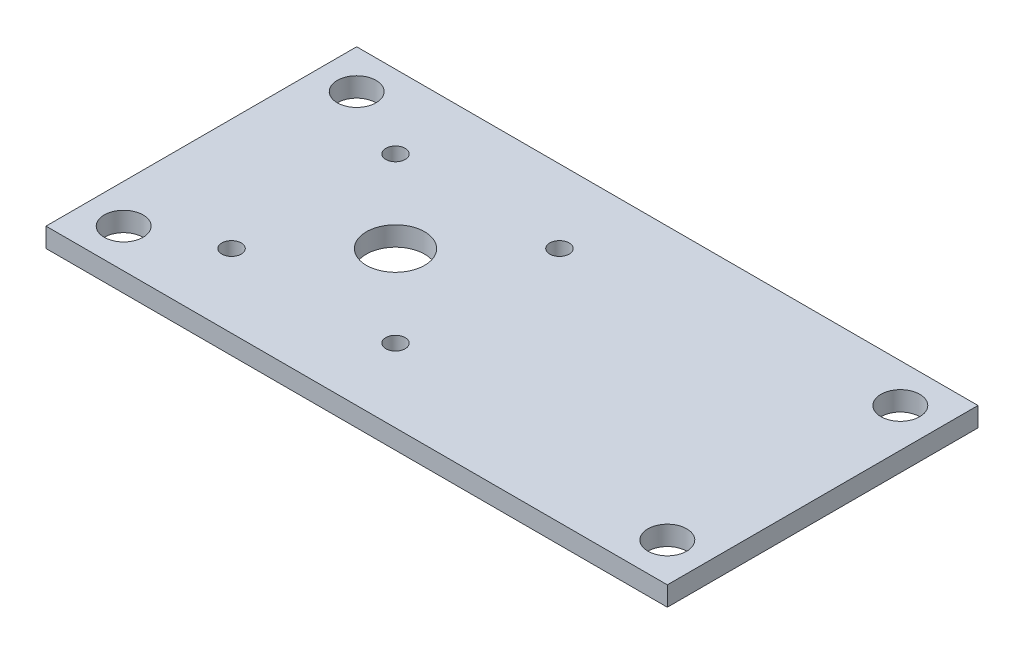
from build123d import *

# Parameters (mm, degrees)
SKETCH1_W               = 203.2
SKETCH1_H               = 101.6
BOSS_EXTRUDE1_DEPTH     = 6.35
SKETCH2_R               = 9.525
CUT_EXTRUDE1_DEPTH      = 228.273233136
SKETCH3_R               = 6.35
CUT_EXTRUDE2_DEPTH      = 228.273233136
MIRROR2_COPY_1_SKETCH_R = 6.35
MIRROR2_COPY_1_DEPTH    = 228.273233136
SKETCH4_R               = 3.175
CUT_EXTRUDE3_DEPTH      = 228.273233136
CIRPATTERN1_COUNT       = 4


with BuildPart() as part:
    # Sketch1 → Boss-Extrude1 (new body)
    with BuildSketch(Plane(origin=(0, 0, 0), x_dir=(1, 0, 0), z_dir=(0, 1, 0))):
        with Locations((101.6, 50.8)):
            Rectangle(SKETCH1_W, SKETCH1_H)
    extrude(amount=BOSS_EXTRUDE1_DEPTH)

    # Sketch2 → Cut-Extrude1 (cut, through all)
    with BuildSketch(Plane(origin=(0, 6.35, 0), x_dir=(1, 0, 0), z_dir=(0, 1, 0))):
        with Locations(Location((63.5, 50.8, 0), (0, 0, 270))):
            Circle(SKETCH2_R)
    extrude(amount=-CUT_EXTRUDE1_DEPTH, mode=Mode.SUBTRACT)

    # Sketch3 → Cut-Extrude2 (cut, through all)
    with BuildSketch(Plane(origin=(0, 6.35, 0), x_dir=(1, 0, 0), z_dir=(0, 1, 0))):
        with Locations(Location((12.7, 88.9, 0), (0, 0, 270))):
            Circle(SKETCH3_R)
    cut_extrude2 = extrude(amount=-CUT_EXTRUDE2_DEPTH, mode=Mode.SUBTRACT)

    # Mirror1: Cut-Extrude2 across plane
    add(cut_extrude2.mirror(Plane.XY.offset(-50.8)), mode=Mode.SUBTRACT)

    # Mirror2: Cut-Extrude2 across plane
    add(cut_extrude2.mirror(Plane.ZY.offset(-101.6)), mode=Mode.SUBTRACT)

    # Mirror2 copy 1 sketch → Mirror2 copy 1 (cut, through all)
    with BuildSketch(Plane(origin=(203.2, 6.35, -101.6), x_dir=(-1, 0, 0), z_dir=(0, 1, 0))):
        with Locations(Location((12.7, 88.9, 0), (0, 0, 270))):
            Circle(MIRROR2_COPY_1_SKETCH_R)
    extrude(amount=-MIRROR2_COPY_1_DEPTH, mode=Mode.SUBTRACT)

    # Sketch4 → Cut-Extrude3 (cut, through all)
    with BuildSketch(Plane(origin=(0, 6.35, 0), x_dir=(1, 0, 0), z_dir=(0, 1, 0))):
        with Locations(Location((36.693935479, 77.606064521, 0), (0, 0, 270))):
            Circle(SKETCH4_R)
    cut_extrude3 = extrude(amount=-CUT_EXTRUDE3_DEPTH, mode=Mode.SUBTRACT)

    # CirPattern1: Cut-Extrude3 ×4 about axis
    cirpattern1_axis = Axis((63.5, 0, -50.8), (0, 1, 0))
    for i in range(1, CIRPATTERN1_COUNT):
        add(cut_extrude3.rotate(cirpattern1_axis, i * 360 / CIRPATTERN1_COUNT), mode=Mode.SUBTRACT)


solid = part.part
